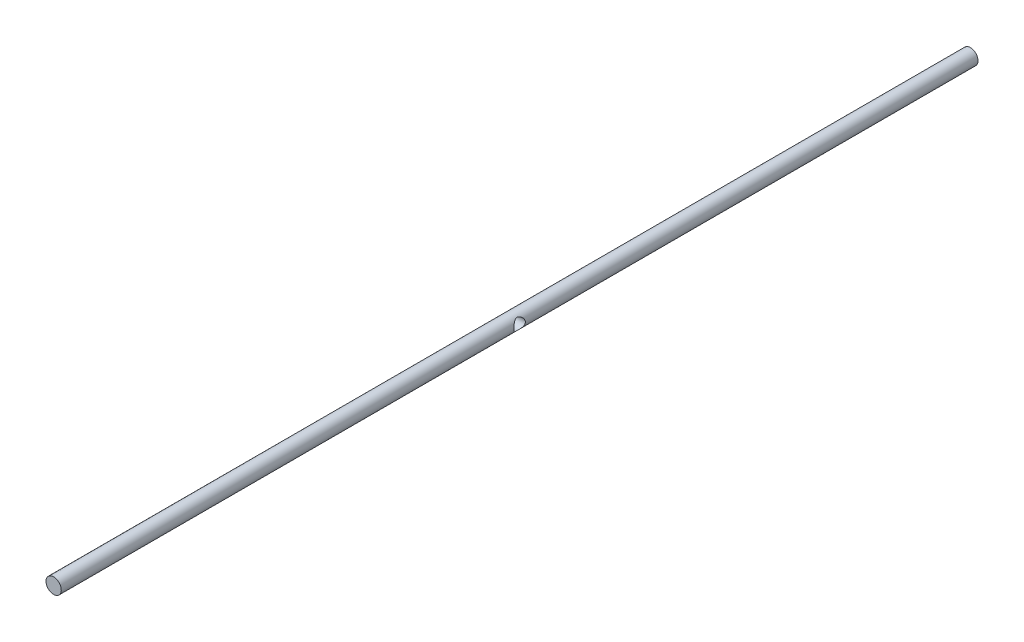
from build123d import *

# Parameters (mm, degrees)
SKETCH1_R               = 6.35
BOSS_EXTRUDE1_DEPTH     = 381
CUT_EXTRUDE1_DEPTH      = 382.105818638
CUT_EXTRUDE1_DEPTH_BACK = 382.105818638
SKETCH4_R               = 4.7625


with BuildPart() as part:
    # Sketch1 → Boss-Extrude1 (new, symmetric)
    with BuildSketch(Plane.XY):
        Circle(SKETCH1_R)
    extrude(amount=BOSS_EXTRUDE1_DEPTH, both=True)

    # Sketch4 → Cut-Extrude1 (cut, two sides: drawn at the far end of the back side and taken through both)
    with BuildSketch(Plane(origin=(0, 0, 0), x_dir=(0, 0, -1), z_dir=(1, 0, 0)).offset(-CUT_EXTRUDE1_DEPTH_BACK)):
        Circle(SKETCH4_R)
    extrude(amount=CUT_EXTRUDE1_DEPTH + CUT_EXTRUDE1_DEPTH_BACK, mode=Mode.SUBTRACT)


solid = part.part
